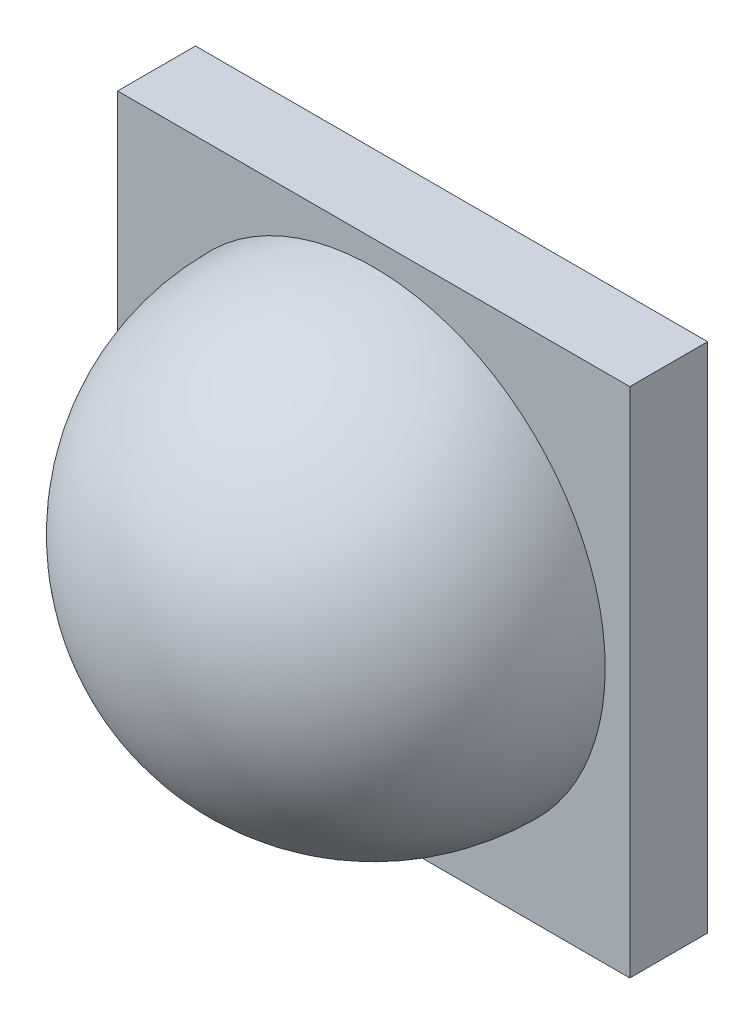
from build123d import *

# Parameters (mm, degrees)
SKETCH1_W           = 5
SKETCH1_H           = 5
BOSS_EXTRUDE1_DEPTH = 0.76


with BuildPart() as part:
    # Sketch1 → Boss-Extrude1 (new body)
    with BuildSketch(Plane.XY):
        Rectangle(SKETCH1_W, SKETCH1_H)
    extrude(amount=BOSS_EXTRUDE1_DEPTH)

    # Sketch2 → Revolve1 (revolve)
    with BuildSketch(Plane(origin=(0, 0, 0), x_dir=(1, 0, 0), z_dir=(0, 1, 0))):
        with BuildLine():
            Line((0, -0.76), (2.26, -0.76))
            ThreePointArc((2.26, -0.76), (1.598061325, -2.358061325), (0, -3.02))
            Line((0, -3.02), (0, -0.76))
        make_face()
    revolve(axis=Axis((0, 0, 0.76), (0, 0, 1)))


solid = part.part
